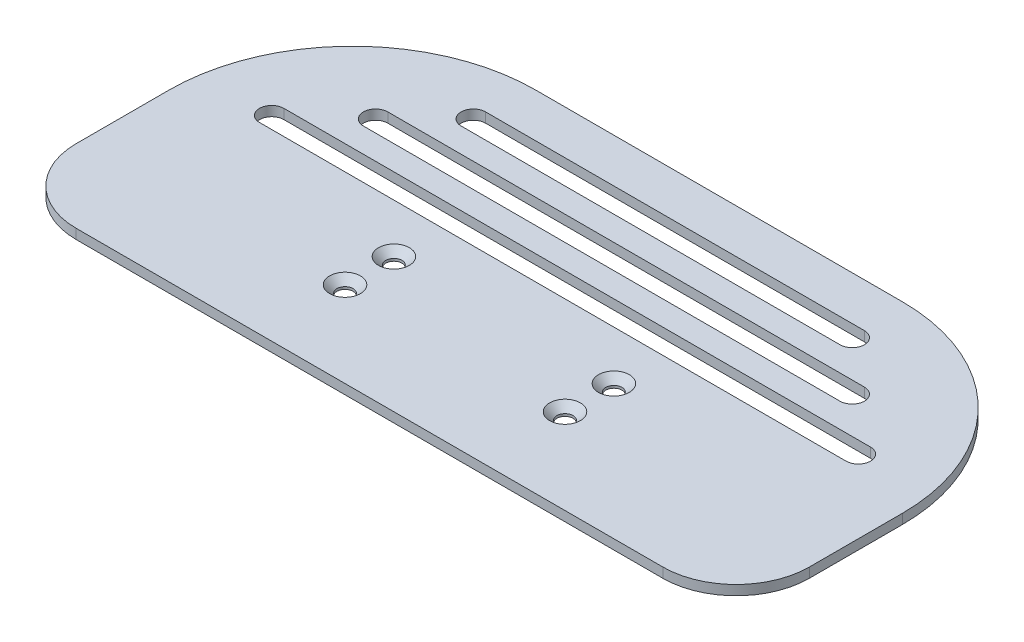
from build123d import *

# Parameters (mm, degrees)
RESSALTO_EXTRUS_O1_DEPTH  = 2
CORTE_EXTRUS_O1_DEPTH     = 167.217478022
PADR_O_LINEAR1_COUNT      = 2
PADR_O_LINEAR1_PITCH      = 90
PADR_O_LINEAR1_COUNT_DIR2 = 2
PADR_O_LINEAR1_PITCH_DIR2 = 20


with BuildPart() as part:
    # Esboço2 → Ressalto-extrusão1 (new, symmetric)
    with BuildSketch(Plane(origin=(0, 0, 0), x_dir=(1, 0, 0), z_dir=(0, 1, 0))):
        with BuildLine():
            Line((75, 71.5), (-75, 71.5))
            ThreePointArc((-75, 71.5), (-128.033008589, 49.533008589), (-150, -3.5))
            Line((-150, -3.5), (-150, -41.5))
            ThreePointArc((-150, -41.5), (-141.213203436, -62.713203436), (-120, -71.5))
            Line((-120, -71.5), (120, -71.5))
            ThreePointArc((120, -71.5), (141.213203436, -62.713203436), (150, -41.5))
            Line((150, -41.5), (150, -3.5))
            ThreePointArc((150, -3.5), (128.033008589, 49.533008589), (75, 71.5))
        make_face()
    extrude(amount=RESSALTO_EXTRUS_O1_DEPTH, both=True)

    # Esboço3 → Corte-extrusão1 (cut, through all)
    with BuildSketch(Plane(origin=(0, 2, 0), x_dir=(1, 0, 0), z_dir=(0, 1, 0))):
        with BuildLine():
            Line((-77.5, 53.5), (77.5, 53.5))
            ThreePointArc((77.5, 53.5), (82.5, 48.5), (77.5, 43.5))
            Line((77.5, 43.5), (-77.5, 43.5))
            ThreePointArc((-77.5, 43.5), (-82.5, 48.5), (-77.5, 53.5))
        make_face()
        with BuildLine():
            Line((-97.5, 33.5), (97.5, 33.5))
            ThreePointArc((97.5, 33.5), (102.5, 28.5), (97.5, 23.5))
            Line((97.5, 23.5), (-97.5, 23.5))
            ThreePointArc((-97.5, 23.5), (-102.5, 28.5), (-97.5, 33.5))
        make_face()
        with BuildLine():
            Line((-120, 13.5), (120, 13.5))
            ThreePointArc((120, 13.5), (125, 8.5), (120, 3.5))
            Line((120, 3.5), (-120, 3.5))
            ThreePointArc((-120, 3.5), (-125, 8.5), (-120, 13.5))
        make_face()
    extrude(amount=-CORTE_EXTRUS_O1_DEPTH, mode=Mode.SUBTRACT)

    # Esboço5 → Escareado para parafuso com cabeça escareada elevada de M61 (revolve, cut)
    with BuildSketch(Plane(origin=(-45, 2, 36.5), x_dir=(0, 0, 1), z_dir=(1, 0, 0))):
        Polygon((0, 0), (0, 4), (3.3, 4), (3.3, 3), (6.3, 0), align=None)
    escareado_para_parafuso_com_cabe_a_escar = revolve(axis=Axis((-45, 8.35, 36.5), (0, -1, 0)), mode=Mode.SUBTRACT)

    # Padrão linear1: Escareado para parafuso com cabe_a escar 2 × 2
    with Locations(*[(i * PADR_O_LINEAR1_PITCH, 0, -j * PADR_O_LINEAR1_PITCH_DIR2) for i in range(PADR_O_LINEAR1_COUNT) for j in range(PADR_O_LINEAR1_COUNT_DIR2) if (i, j) != (0, 0)]):
        add(escareado_para_parafuso_com_cabe_a_escar, mode=Mode.SUBTRACT)


solid = part.part
